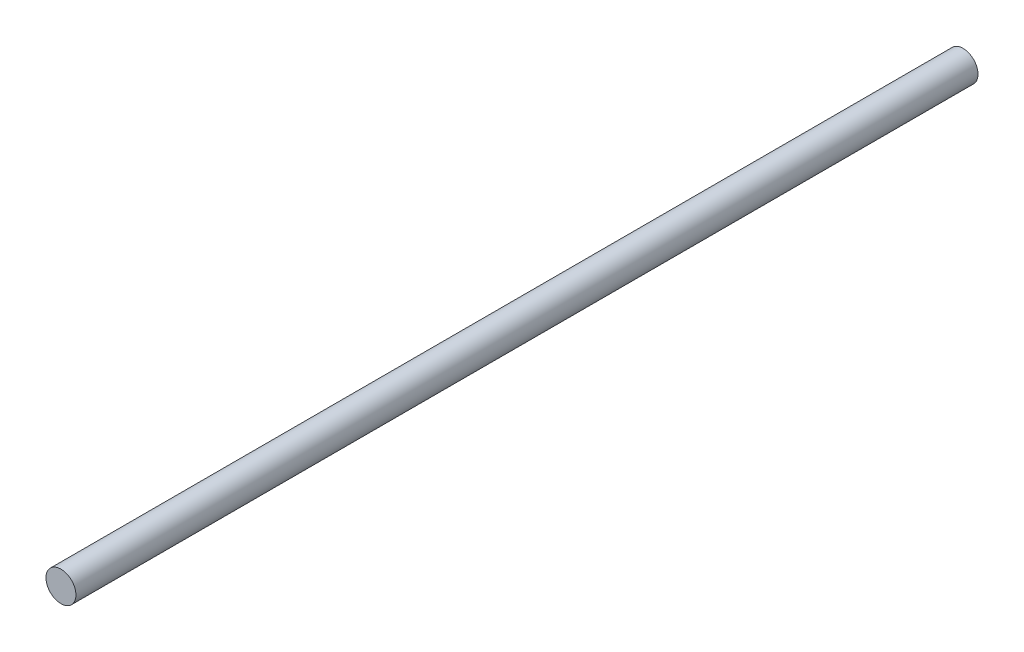
from build123d import *

# Parameters (mm, degrees)
SKETCH1_R           = 6.3246
BOSS_EXTRUDE1_DEPTH = 381


with BuildPart() as part:
    # Sketch1 → Boss-Extrude1 (new body)
    with BuildSketch(Plane.XY):
        Circle(SKETCH1_R)
    extrude(amount=BOSS_EXTRUDE1_DEPTH)


solid = part.part
